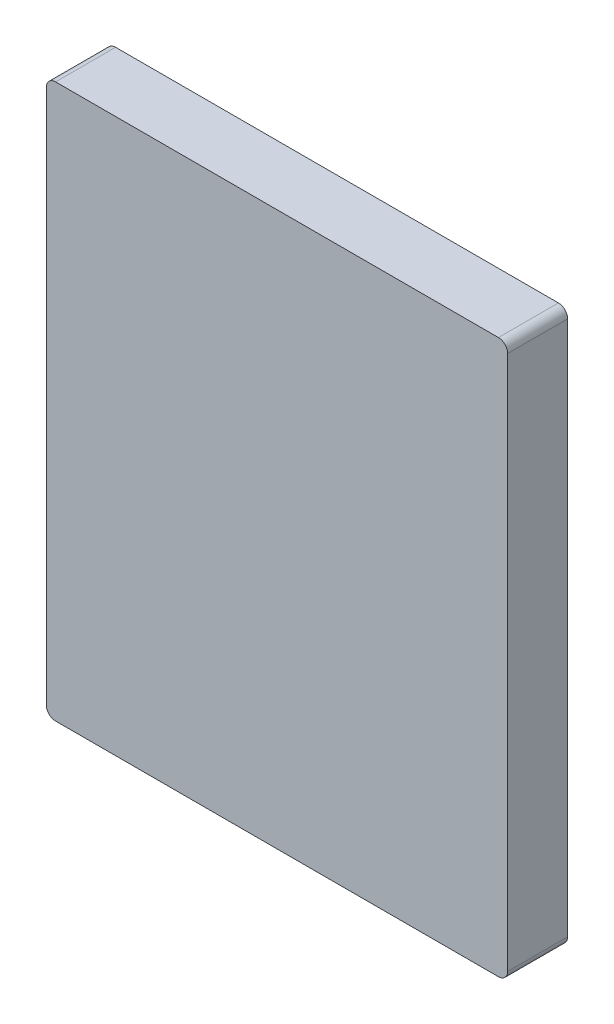
from build123d import *

# Parameters (mm, degrees)
SKETCH1_W           = 10
SKETCH1_H           = 12
BOSS_EXTRUDE1_DEPTH = 1.3
FILLET1_R           = 0.2


with BuildPart() as part:
    # Sketch1 → Boss-Extrude1 (new body)
    with BuildSketch(Plane.XY):
        Rectangle(SKETCH1_W, SKETCH1_H)
    extrude(amount=BOSS_EXTRUDE1_DEPTH)

    # Fillet1
    fillet1_edges = [part.edges().sort_by_distance(p)[0] for p in [
        (-5, 6, 0.65),
        (5, 6, 0.65),
        (-5, -6, 0.65),
        (5, -6, 0.65),
    ]]
    fillet(fillet1_edges, radius=FILLET1_R)


solid = part.part
